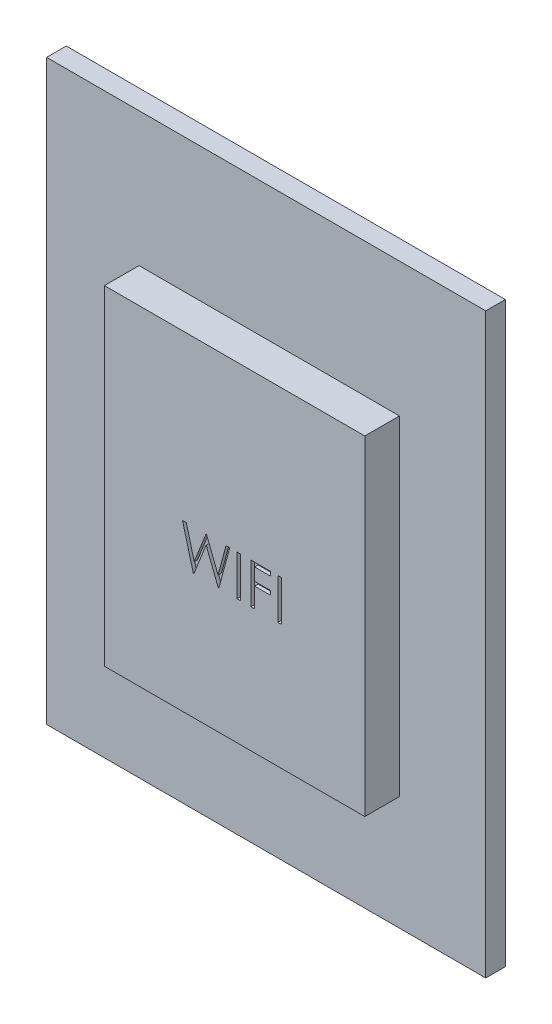
from build123d import *

# Parameters (mm, degrees)
SKETCH1_W           = 38
SKETCH1_H           = 50
BOSS_EXTRUDE1_DEPTH = 1.7
SKETCH3_W           = 22.534452401
SKETCH3_H           = 28.525832834
BOSS_EXTRUDE2_DEPTH = 3
SKETCH4_W           = 0.314102564
SKETCH4_H           = 3.5
CUT_EXTRUDE2_DEPTH  = 0.3


with BuildPart() as part:
    # Sketch1 → Boss-Extrude1 (new body)
    with BuildSketch(Plane.XY):
        Rectangle(SKETCH1_W, SKETCH1_H)
    extrude(amount=BOSS_EXTRUDE1_DEPTH)

    # Sketch3 → Boss-Extrude2 (add)
    with BuildSketch(Plane.XY.offset(1.7)):
        with Locations((0.266789104, -0.871264125)):
            Rectangle(SKETCH3_W, SKETCH3_H)
    extrude(amount=BOSS_EXTRUDE2_DEPTH)

    # Sketch4 → Cut-Extrude2 (cut)
    with BuildSketch(Plane.XY.offset(4.7)):
        Polygon((-4.236247821, -0.83301235), (-3.91162843, -0.83301235), (-3.226632437, -3.399819241), (-2.207902469, -0.83301235), (-2.162329552, -0.83301235), (-1.162529873, -3.382291197), (-0.47402827, -0.83301235), (-0.152914488, -0.83301235), (-1.096624424, -4.33301235), (-1.141496219, -4.33301235), (-2.194581155, -1.656129338), (-3.260286283, -4.33301235), (-3.305158078, -4.33301235), align=None)
        with Locations((0.632341922, -2.58301235)):
            Rectangle(SKETCH4_W, SKETCH4_H)
        Polygon((1.686829102, -0.83301235), (3.391957307, -0.83301235), (3.391957307, -1.191986709), (2.000931666, -1.191986709), (2.000931666, -2.268909786), (3.391957307, -2.268909786), (3.391957307, -2.627884145), (2.000931666, -2.627884145), (2.000931666, -4.33301235), (1.686829102, -4.33301235), align=None)
        with Locations((4.177213717, -2.58301235)):
            Rectangle(SKETCH4_W, SKETCH4_H)
    extrude(amount=-CUT_EXTRUDE2_DEPTH, mode=Mode.SUBTRACT)


solid = part.part
